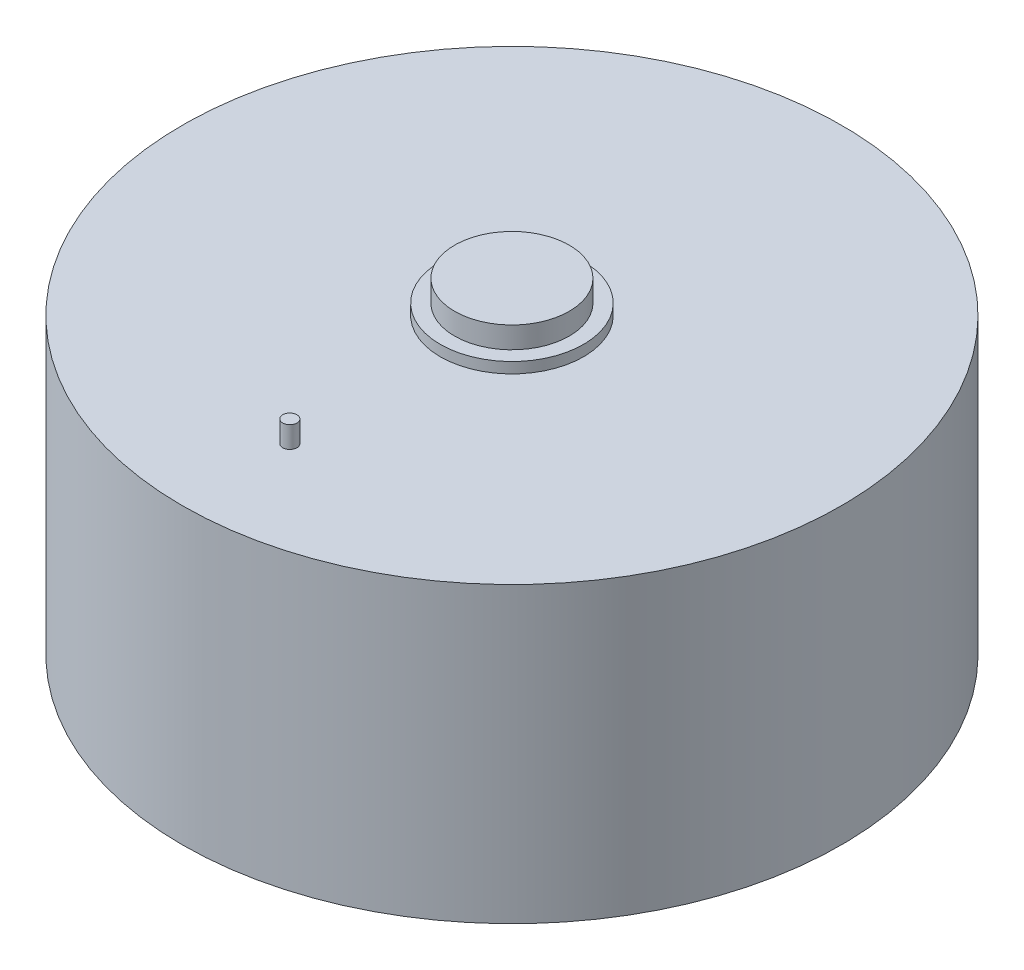
from build123d import *

# Parameters (mm, degrees)
ESQUISSE1_R        = 46
BOSS_EXTRU_1_DEPTH = 41
ESQUISSE2_R        = 10
BOSS_EXTRU_2_DEPTH = 1.5
ESQUISSE3_R        = 8
BOSS_EXTRU_3_DEPTH = 3
ESQUISSE4_R        = 0.995
BOSS_EXTRU_4_DEPTH = 3


with BuildPart() as part:
    # Esquisse1 → Boss.-Extru.1 (new body)
    with BuildSketch(Plane(origin=(0, 0, 0), x_dir=(1, 0, 0), z_dir=(0, 1, 0))):
        with Locations(Location((0, 0, 0), (0, 0, 270))):
            Circle(ESQUISSE1_R)
    extrude(amount=BOSS_EXTRU_1_DEPTH)

    # Esquisse2 → Boss.-Extru.2 (add)
    with BuildSketch(Plane(origin=(0, 41, 0), x_dir=(1, 0, 0), z_dir=(0, 1, 0))):
        with Locations(Location((0, 0, 0), (0, 0, 270))):
            Circle(ESQUISSE2_R)
    extrude(amount=BOSS_EXTRU_2_DEPTH)

    # Esquisse3 → Boss.-Extru.3 (add)
    with BuildSketch(Plane(origin=(0, 42.5, 0), x_dir=(1, 0, 0), z_dir=(0, 1, 0))):
        with Locations(Location((0, 0, 0), (0, 0, 270))):
            Circle(ESQUISSE3_R)
    extrude(amount=BOSS_EXTRU_3_DEPTH)

    # Esquisse4 → Boss.-Extru.4 (add)
    with BuildSketch(Plane(origin=(0, 41, 0), x_dir=(1, 0, 0), z_dir=(0, 1, 0))):
        with Locations(Location((0, -31, 0), (0, 0, 270))):
            Circle(ESQUISSE4_R)
    extrude(amount=BOSS_EXTRU_4_DEPTH)


solid = part.part
